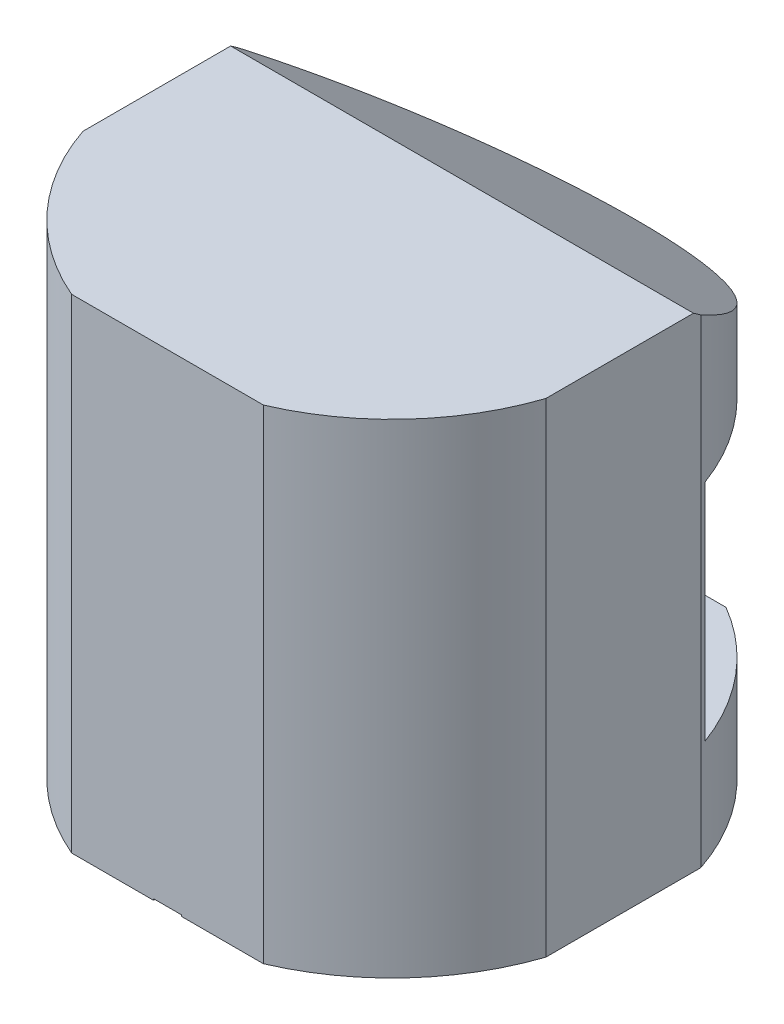
from build123d import *

# Parameters (mm, degrees)
BOSS_EXTRU_1_DEPTH           = 345
ENL_V_MAT_EXTRU_1_DEPTH      = 421.149973224
ENL_V_MAT_EXTRU_1_DEPTH_BACK = 421.149973224
ESQUISSE5_W                  = 400
ESQUISSE5_H                  = 70
ENL_V_MAT_EXTRU_3_DEPTH      = 75
ESQUISSE6_W                  = 20
ESQUISSE6_H                  = 21
ENL_V_MAT_EXTRU_4_DEPTH      = 1


with BuildPart() as part:
    # Esquisse1 → Boss.-Extru.1 (new body)
    with BuildSketch(Plane(origin=(0, 0, 0), x_dir=(1, 0, 0), z_dir=(0, 1, 0))):
        with BuildLine():
            Line((-165, -55.235857919), (-165, 55.235857919))
            ThreePointArc((-165, 55.235857919), (0, 174), (165, 55.235857919))
            Line((165, 55.235857919), (165, -55.235857919))
            ThreePointArc((165, -55.235857919), (127.908511428, -117.963607542), (68.381283989, -160))
            Line((68.381283989, -160), (-68.381283989, -160))
            ThreePointArc((-68.381283989, -160), (-127.908511428, -117.963607542), (-165, -55.235857919))
        make_face()
    extrude(amount=BOSS_EXTRU_1_DEPTH)

    # Esquisse3 → Enlèv. mat.-Extru.1 (cut, two sides: drawn at the far end of the back side and taken through both)
    with BuildSketch(Plane.ZY.offset(-ENL_V_MAT_EXTRU_1_DEPTH_BACK)):
        Polygon((-50, 345), (-542.711062326, 0), (-542.711062326, 345), align=None)
        Polygon((-60, 150), (-130, 150), (-130, 75), (-150, 75), (-150, 0), (-174, 0), (-174, 235), (-60, 235), align=None)
    extrude(amount=ENL_V_MAT_EXTRU_1_DEPTH + ENL_V_MAT_EXTRU_1_DEPTH_BACK, mode=Mode.SUBTRACT)

    # Esquisse5 → Enlèv. mat.-Extru.3 (cut)
    with BuildSketch(Plane(origin=(0, 150, 0), x_dir=(1, 0, 0), z_dir=(0, 1, 0))):
        with Locations((0, 95)):
            Rectangle(ESQUISSE5_W, ESQUISSE5_H)
    extrude(amount=-ENL_V_MAT_EXTRU_3_DEPTH, mode=Mode.SUBTRACT)

    # Esquisse6 → Enlèv. mat.-Extru.4 (cut)
    with BuildSketch(Plane.XZ):
        with Locations((0, 149.5)):
            Rectangle(ESQUISSE6_W, ESQUISSE6_H)
    extrude(amount=-ENL_V_MAT_EXTRU_4_DEPTH, mode=Mode.SUBTRACT)


solid = part.part
